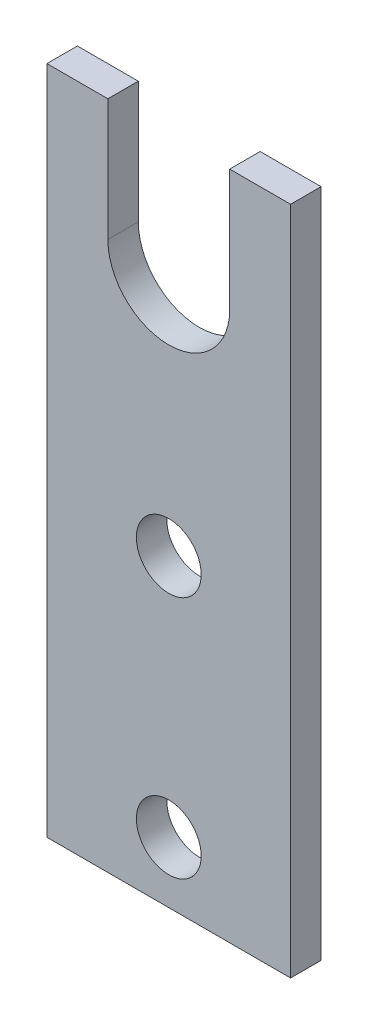
from build123d import *

# Parameters (mm, degrees)
SKETCH1_W               = 25.4
SKETCH1_H               = 69.85
BOSS_EXTRUDE1_DEPTH     = 3.175
CUT_EXTRUDE1_DEPTH      = 38.297804895
F_1_4_CLEARANCE_HOLE1_D = 6.7564


with BuildPart() as part:
    # Sketch1 → Boss-Extrude1 (new body)
    with BuildSketch(Plane.XY):
        Rectangle(SKETCH1_W, SKETCH1_H)
    extrude(amount=BOSS_EXTRUDE1_DEPTH)

    # Sketch2 → Cut-Extrude1 (cut, through all)
    with BuildSketch(Plane.XY.offset(3.175)):
        with BuildLine():
            Line((-6.35, 34.925), (-6.35, 22.225))
            ThreePointArc((-6.35, 22.225), (0, 15.875), (6.35, 22.225))
            Line((6.35, 22.225), (6.35, 34.925))
            Line((6.35, 34.925), (-6.35, 34.925))
        make_face()
    extrude(amount=-CUT_EXTRUDE1_DEPTH, mode=Mode.SUBTRACT)

    # 1/4 Clearance Hole1 (through all)
    with Locations(Plane.XY.offset(3.175)):
        with Locations((0, -28.575), (0, -3.175)):
            Hole(F_1_4_CLEARANCE_HOLE1_D / 2)


solid = part.part
